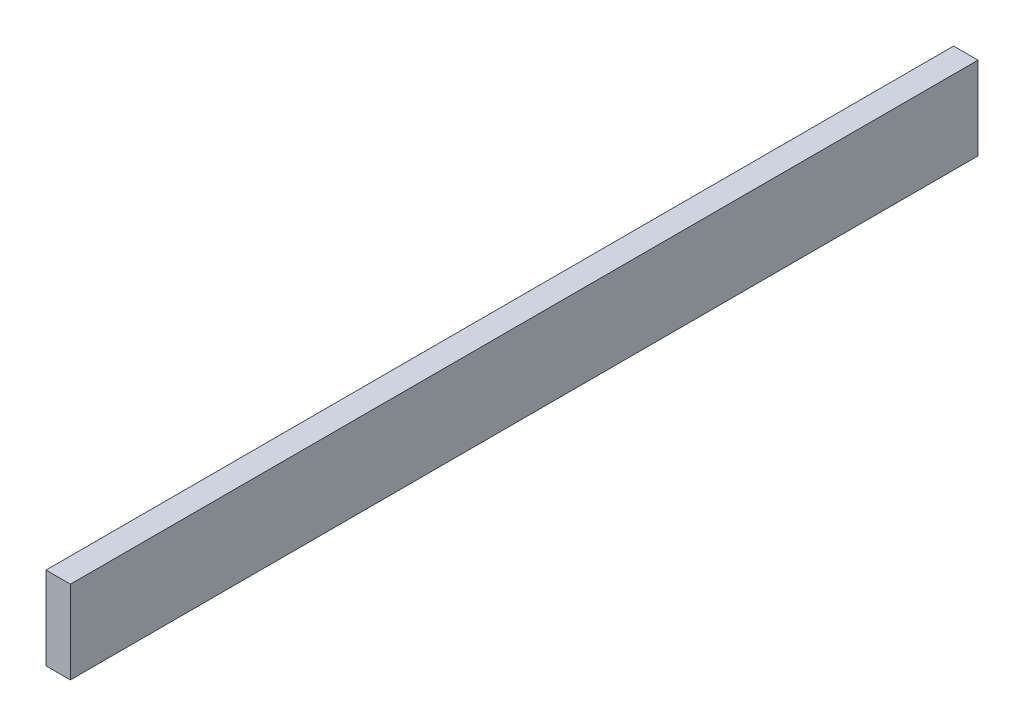
from build123d import *

# Parameters (mm, degrees)
SKIZZE1_W                       = 186
SKIZZE1_H                       = 17
AUFSATZ_LINEAR_AUSTRAGEN1_DEPTH = 5


with BuildPart() as part:
    # Skizze1 → Aufsatz-Linear austragen1 (new body)
    with BuildSketch(Plane(origin=(0, 0, 0), x_dir=(0, 0, -1), z_dir=(1, 0, 0))):
        with Locations((93, 8.5)):
            Rectangle(SKIZZE1_W, SKIZZE1_H)
    extrude(amount=AUFSATZ_LINEAR_AUSTRAGEN1_DEPTH)


solid = part.part
